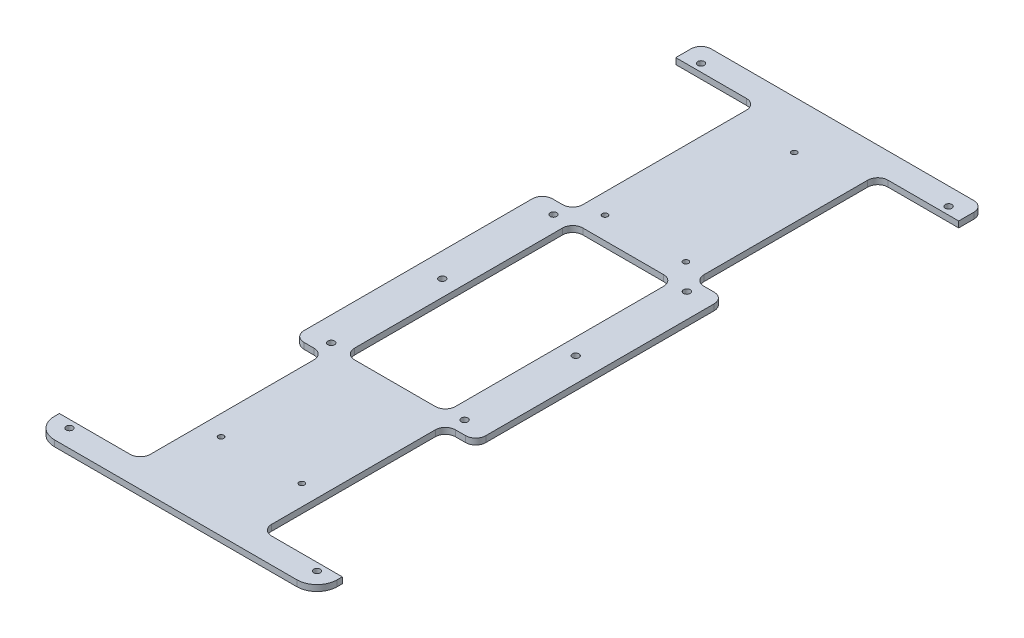
from build123d import *

# Parameters (mm, degrees)
BOSS_EXTRUDE1_DEPTH = 3
FILLET1_R           = 10
FILLET2_R           = 5
SKETCH2_R           = 1.65
CUT_EXTRUDE1_DEPTH  = 359.481519747
SKETCH3_R           = 1.65
CUT_EXTRUDE2_DEPTH  = 359.481519747
SKETCH4_R           = 1.65
CUT_EXTRUDE3_DEPTH  = 359.481519747
FILLET3_R           = 5
SKETCH5_R           = 1.35
CUT_EXTRUDE4_DEPTH  = 10
SKETCH6_W           = 50
SKETCH6_H           = 113
CUT_EXTRUDE5_DEPTH  = 10
FILLET4_R           = 5


with BuildPart() as part:
    # Sketch1 → Boss-Extrude1 (new body)
    with BuildSketch(Plane(origin=(0, 0, 0), x_dir=(1, 0, 0), z_dir=(0, 1, 0))):
        Polygon((0, 0), (140, 0), (140, 12.5), (100, 12.5), (100, 103.5), (115, 103.5), (115, 226.5), (100, 226.5), (100, 317.5), (140, 317.5), (140, 330), (0, 330), (0, 317.5), (40, 317.5), (40, 226.5), (25, 226.5), (25, 103.5), (40, 103.5), (40, 12.5), (0, 12.5), align=None)
    extrude(amount=BOSS_EXTRUDE1_DEPTH)

    # Fillet1
    fillet1_edges = [part.edges().sort_by_distance(p)[0] for p in [
        (140, 1.5, 0),
        (0, 1.5, 0),
    ]]
    fillet(fillet1_edges, radius=FILLET1_R)

    # Fillet2
    fillet2_edges = [part.edges().sort_by_distance(p)[0] for p in [
        (25, 1.5, -103.5),
        (25, 1.5, -226.5),
        (0, 1.5, -330),
        (140, 1.5, -330),
        (115, 1.5, -226.5),
        (115, 1.5, -103.5),
    ]]
    fillet(fillet2_edges, radius=FILLET2_R)

    # Sketch2 → Cut-Extrude1 (cut, through all)
    with BuildSketch(Plane(origin=(0, 3, 0), x_dir=(1, 0, 0), z_dir=(0, 1, 0))):
        with Locations(Location((37, 220, 0), (0, 0, 270))):
            Circle(SKETCH2_R)
        with Locations(Location((37, 165, 0), (0, 0, 270))):
            Circle(SKETCH2_R)
        with Locations(Location((37, 110, 0), (0, 0, 270))):
            Circle(SKETCH2_R)
        with Locations(Location((103, 110, 0), (0, 0, 90))):
            Circle(SKETCH2_R)
        with Locations(Location((103, 165, 0), (0, 0, 90))):
            Circle(SKETCH2_R)
        with Locations(Location((103, 220, 0), (0, 0, 90))):
            Circle(SKETCH2_R)
    extrude(amount=-CUT_EXTRUDE1_DEPTH, mode=Mode.SUBTRACT)

    # Sketch3 → Cut-Extrude2 (cut, through all)
    with BuildSketch(Plane(origin=(0, 3, 0), x_dir=(1, 0, 0), z_dir=(0, 1, 0))):
        with Locations(Location((8.75, 8.75, 0), (0, 0, 270))):
            Circle(SKETCH3_R)
        with Locations(Location((131.25, 8.75, 0), (0, 0, 90))):
            Circle(SKETCH3_R)
    extrude(amount=-CUT_EXTRUDE2_DEPTH, mode=Mode.SUBTRACT)

    # Sketch4 → Cut-Extrude3 (cut, through all)
    with BuildSketch(Plane(origin=(0, 3, 0), x_dir=(1, 0, 0), z_dir=(0, 1, 0))):
        with Locations(Location((8.75, 321.25, 0), (0, 0, 270))):
            Circle(SKETCH4_R)
        with Locations(Location((131.25, 321.25, 0), (0, 0, 90))):
            Circle(SKETCH4_R)
    extrude(amount=-CUT_EXTRUDE3_DEPTH, mode=Mode.SUBTRACT)

    # Fillet3
    fillet3_edges = [part.edges().sort_by_distance(p)[0] for p in [
        (40, 1.5, -12.5),
        (40, 1.5, -103.5),
        (40, 1.5, -226.5),
        (40, 1.5, -317.5),
        (100, 1.5, -317.5),
        (100, 1.5, -226.5),
        (100, 1.5, -103.5),
        (100, 1.5, -12.5),
    ]]
    fillet(fillet3_edges, radius=FILLET3_R)

    # Sketch5 → Cut-Extrude4 (cut)
    with BuildSketch(Plane(origin=(0, 3, 0), x_dir=(1, 0, 0), z_dir=(0, 1, 0))):
        with Locations(Location((50, 42.5, 0), (0, 0, 270))):
            Circle(SKETCH5_R)
        with Locations(Location((90, 42.5, 0), (0, 0, 270))):
            Circle(SKETCH5_R)
        with Locations(Location((50, 232.5, 0), (0, 0, 270))):
            Circle(SKETCH5_R)
        with Locations(Location((90, 232.5, 0), (0, 0, 270))):
            Circle(SKETCH5_R)
        with Locations(Location((70, 306.15, 0), (0, 0, 270))):
            Circle(SKETCH5_R)
    extrude(amount=-CUT_EXTRUDE4_DEPTH, mode=Mode.SUBTRACT)

    # Sketch6 → Cut-Extrude5 (cut)
    with BuildSketch(Plane(origin=(0, 3, 0), x_dir=(1, 0, 0), z_dir=(0, 1, 0))):
        with Locations((70, 165)):
            Rectangle(SKETCH6_W, SKETCH6_H)
    extrude(amount=-CUT_EXTRUDE5_DEPTH, mode=Mode.SUBTRACT)

    # Fillet4
    fillet4_edges = [part.edges().sort_by_distance(p)[0] for p in [
        (45, 1.5, -108.5),
        (45, 1.5, -221.5),
        (95, 1.5, -221.5),
        (95, 1.5, -108.5),
    ]]
    fillet(fillet4_edges, radius=FILLET4_R)


solid = part.part
